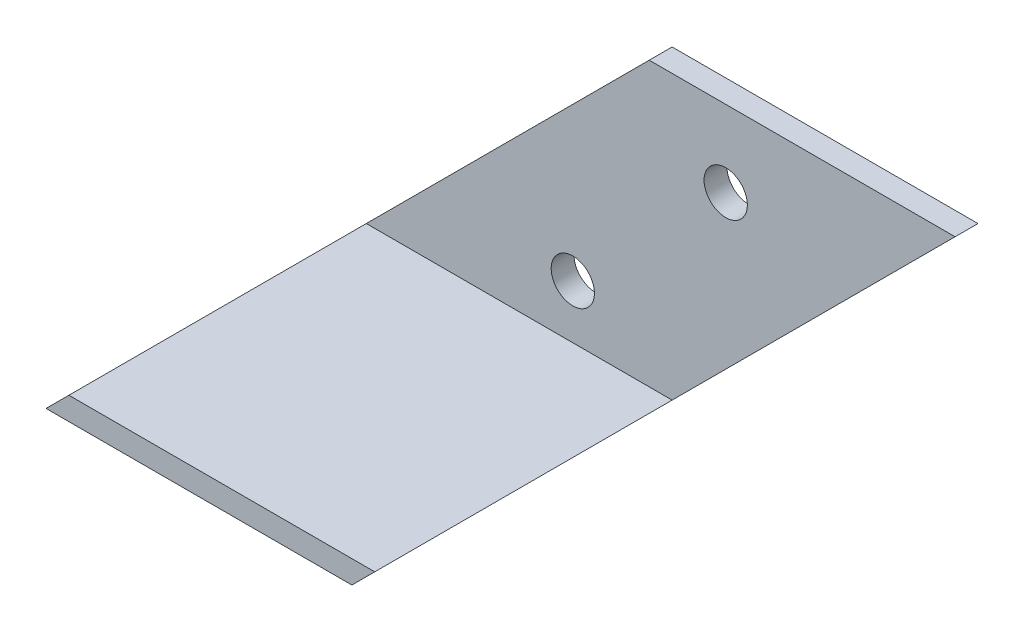
from build123d import *

# Parameters (mm, degrees)
SKETCH1_W           = 45
SKETCH1_H           = 21.21
BOSS_EXTRUDE1_DEPTH = 1.5875
SKETCH2_W           = 45
SKETCH2_H           = 1.5875
BOSS_EXTRUDE2_DEPTH = 20.62570344
CUT_EXTRUDE3_DEPTH  = 55.482020035
CUT_EXTRUDE4_DEPTH  = 53.373835995


with BuildPart() as part:
    # Sketch1 → Boss-Extrude1 (new body)
    with BuildSketch(Plane.XY):
        with Locations((22.5, 10.605)):
            Rectangle(SKETCH1_W, SKETCH1_H)
    extrude(amount=BOSS_EXTRUDE1_DEPTH)

    # Sketch2 → Boss-Extrude2 (add)
    with BuildSketch(Plane.XY.offset(1.5875)):
        with Locations((22.5, 0.79375)):
            Rectangle(SKETCH2_W, SKETCH2_H)
    extrude(amount=BOSS_EXTRUDE2_DEPTH)

    # Sketch5 → Cut-Extrude3 (cut, through all)
    with BuildSketch(Plane(origin=(0, 0, 0), x_dir=(-1, 0, 0), z_dir=(0, 0, -1))):
        Polygon((-21.21, 21.21), (0, 0), (0, 21.21), align=None)
        Polygon((-45, 0), (-21.213203436, 0), (-42.423203436, 21.21), (-45, 21.21), align=None)
    extrude(amount=-CUT_EXTRUDE3_DEPTH, mode=Mode.SUBTRACT)

    # Sketch4 → Cut-Extrude4 (cut, through all)
    with BuildSketch(Plane(origin=(0, 0, 0), x_dir=(-1, 0, 0), z_dir=(0, 0, -1))):
        with BuildLine():
            ThreePointArc((-14.409101718, 5.3025), (-15.335076569, 6.688319299), (-16.96976189, 6.363160172))
            Line((-16.96976189, 6.363160172), (-14.848441546, 4.241839828))
            ThreePointArc((-14.848441546, 4.241839828), (-14.523282419, 4.728474851), (-14.409101718, 5.3025))
        make_face()
        with BuildLine():
            Line((-14.848441546, 4.241839828), (-16.96976189, 6.363160172))
            ThreePointArc((-16.96976189, 6.363160172), (-16.96976189, 4.241839828), (-14.848441546, 4.241839828))
        make_face()
        with BuildLine():
            ThreePointArc((-25.014101718, 15.9075), (-25.940076569, 17.293319299), (-27.57476189, 16.968160172))
            Line((-27.57476189, 16.968160172), (-25.453441546, 14.846839828))
            ThreePointArc((-25.453441546, 14.846839828), (-25.128282419, 15.333474851), (-25.014101718, 15.9075))
        make_face()
        with BuildLine():
            Line((-25.453441546, 14.846839828), (-27.57476189, 16.968160172))
            ThreePointArc((-27.57476189, 16.968160172), (-27.57476189, 14.846839828), (-25.453441546, 14.846839828))
        make_face()
    extrude(amount=-CUT_EXTRUDE4_DEPTH, mode=Mode.SUBTRACT)


solid = part.part
